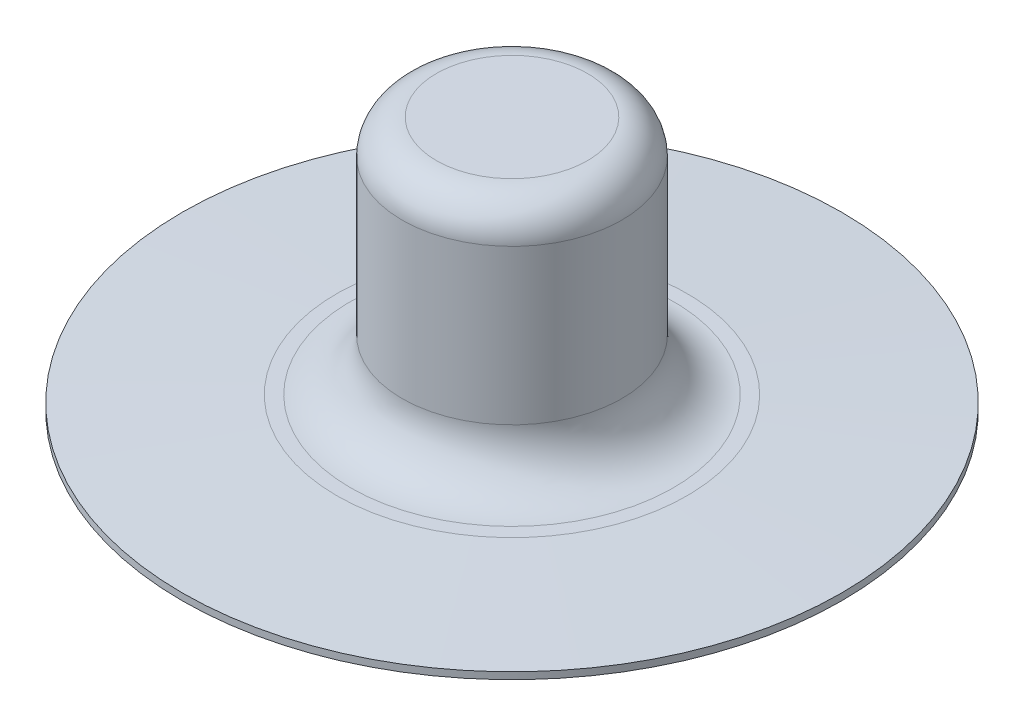
from build123d import *

# Parameters (mm, degrees)
CROQUIS1_R              = 4.8
SALIENTE_EXTRUIR1_DEPTH = 0.2
CROQUIS2_R              = 1.6
SALIENTE_EXTRUIR2_DEPTH = 3.5
REDONDEO1_R             = 0.5
REDONDEO2_R             = 0.75
CROQUIS3_R              = 1.15
CORTAR_EXTRUIR1_DEPTH   = 3
REDONDEO3_R             = 1
CHAFL_N1_SIZE           = 0.1
CHAFL_N1_SIZE2          = 2.25


with BuildPart() as part:
    # Croquis1 → Saliente-Extruir1 (new body)
    with BuildSketch(Plane(origin=(0, 0, 0), x_dir=(1, 0, 0), z_dir=(0, 1, 0))):
        with Locations(Location((0, 0, 0), (0, 0, 270))):
            Circle(CROQUIS1_R)
    extrude(amount=SALIENTE_EXTRUIR1_DEPTH)

    # Croquis2 → Saliente-Extruir2 (add)
    with BuildSketch(Plane(origin=(0, 0.2, 0), x_dir=(1, 0, 0), z_dir=(0, 1, 0))):
        with Locations(Location((0, 0, 0), (0, 0, 270))):
            Circle(CROQUIS2_R)
    extrude(amount=SALIENTE_EXTRUIR2_DEPTH)

    # Redondeo1
    redondeo1_edges = [part.edges().sort_by_distance(p)[0] for p in [
        (0, 3.7, -1.6),
    ]]
    fillet(redondeo1_edges, radius=REDONDEO1_R)

    # Redondeo2
    redondeo2_edges = [part.edges().sort_by_distance(p)[0] for p in [
        (0, 0.2, -1.6),
    ]]
    fillet(redondeo2_edges, radius=REDONDEO2_R)

    # Croquis3 → Cortar-Extruir1 (cut)
    with BuildSketch(Plane.XZ):
        with Locations(Location((0, 0, 0), (0, 0, 270))):
            Circle(CROQUIS3_R)
    extrude(amount=-CORTAR_EXTRUIR1_DEPTH, mode=Mode.SUBTRACT)

    # Redondeo3
    redondeo3_edges = [part.edges().sort_by_distance(p)[0] for p in [
        (0, 0, 1.15),
    ]]
    fillet(redondeo3_edges, radius=REDONDEO3_R)

    # Chaflán1
    chafl_n1_edges = [part.edges().sort_by_distance(p)[0] for p in [
        (0, 0.2, -4.8),
    ]]
    chafl_n1_side = [part.faces().sort_by_distance(p)[0] for p in [
        (0, 0.1, -4.8),
    ]]
    chamfer(chafl_n1_edges, length=CHAFL_N1_SIZE, length2=CHAFL_N1_SIZE2, reference=chafl_n1_side[0])


solid = part.part
